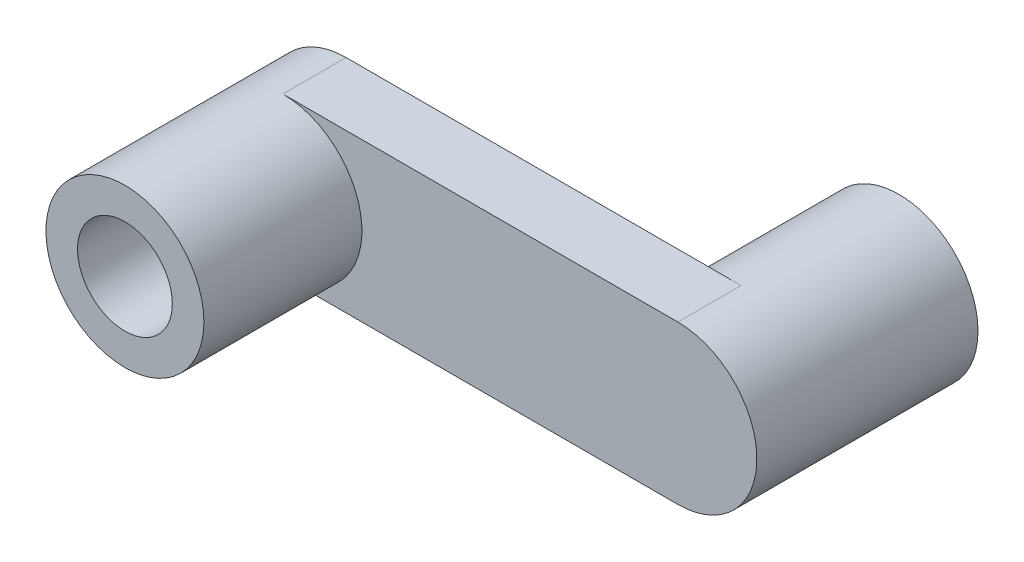
from build123d import *

# Parameters (mm, degrees)
BOSS_EXTRUDE1_DEPTH = 2
BOSS_EXTRUDE2_START = 10
SKETCH3_R           = 5
SKETCH3_R_2         = 3
BOSS_EXTRUDE2_DEPTH = 10
SKETCH4_R           = 5
SKETCH4_R_2         = 3
BOSS_EXTRUDE3_DEPTH = 10


with BuildPart() as part:
    # Sketch2 → Boss-Extrude1 (new, symmetric)
    with BuildSketch(Plane.XY):
        with BuildLine():
            Line((-17.054545455, 5), (7.945454545, 5))
            ThreePointArc((7.945454545, 5), (12.945454545, 0), (7.945454545, -5))
            Line((7.945454545, -5), (-17.054545455, -5))
            ThreePointArc((-17.054545455, -5), (-22.054545455, 0), (-17.054545455, 5))
        make_face()
    extrude(amount=BOSS_EXTRUDE1_DEPTH, both=True)

    # Sketch3 → Boss-Extrude2 (add)
    with BuildSketch(Plane.XY.offset(2).offset(BOSS_EXTRUDE2_START)):
        with Locations(Location((-17.054545455, 0, 0), (0, 0, 270))):
            Circle(SKETCH3_R)
        with Locations((-17.054545455, 0)):
            Circle(SKETCH3_R_2, mode=Mode.SUBTRACT)
    extrude(amount=-BOSS_EXTRUDE2_DEPTH)

    # Sketch4 → Boss-Extrude3 (add)
    with BuildSketch(Plane(origin=(0, 0, -2), x_dir=(-1, 0, 0), z_dir=(0, 0, -1))):
        with Locations((-7.945454545, 0)):
            Circle(SKETCH4_R)
        with Locations((-7.945454545, 0)):
            Circle(SKETCH4_R_2, mode=Mode.SUBTRACT)
    extrude(amount=BOSS_EXTRUDE3_DEPTH)


solid = part.part
